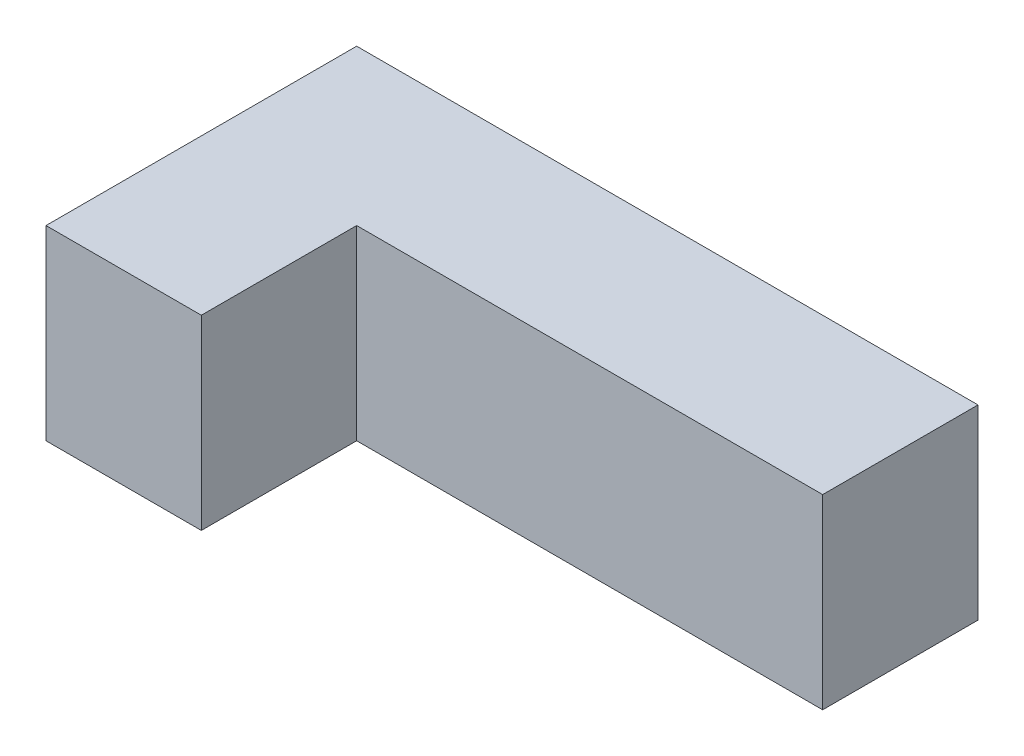
from build123d import *

# Parameters (mm, degrees)
P_IDAT_VYSUNUT_M1_DEPTH = 30


with BuildPart() as part:
    # Skica1 → Přidat vysunutím1 (new body)
    with BuildSketch(Plane(origin=(0, 0, 0), x_dir=(1, 0, 0), z_dir=(0, 1, 0))):
        Polygon((0, 0), (0, 50), (100, 50), (100, 25), (25, 25), (25, 0), align=None)
    extrude(amount=P_IDAT_VYSUNUT_M1_DEPTH)


solid = part.part
